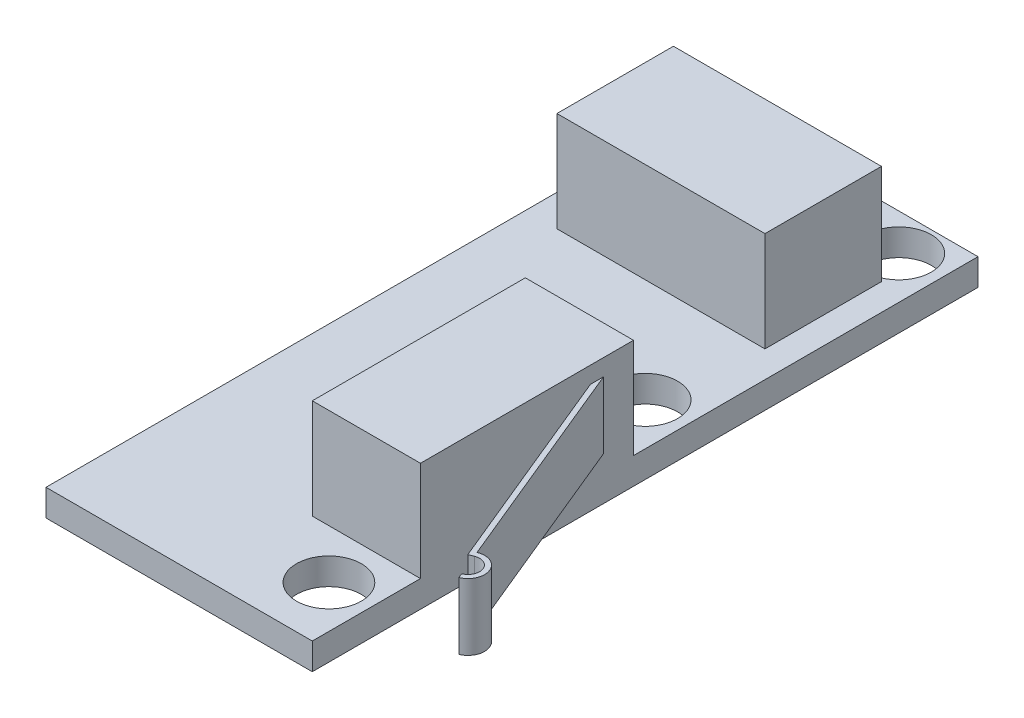
from build123d import *

# Parameters (mm, degrees)
SKETCH1_W           = 16
SKETCH1_H           = 40
BOSS_EXTRUDE1_DEPTH = 1.6
SKETCH2_R           = 1.95
CUT_EXTRUDE1_DEPTH  = 1.6
SKETCH3_W           = 12.5
SKETCH3_H           = 7
SKETCH3_W_2         = 6.5
SKETCH3_H_2         = 12.8
BOSS_EXTRUDE2_DEPTH = 6
BOSS_EXTRUDE3_START = 1
BOSS_EXTRUDE3_DEPTH = 4


with BuildPart() as part:
    # Sketch1 → Boss-Extrude1 (new body)
    with BuildSketch(Plane(origin=(0, 0, 0), x_dir=(1, 0, 0), z_dir=(0, 1, 0))):
        with Locations((8, 20)):
            Rectangle(SKETCH1_W, SKETCH1_H)
    extrude(amount=BOSS_EXTRUDE1_DEPTH)

    # Sketch2 → Cut-Extrude1 (cut)
    with BuildSketch(Plane(origin=(0, 1.6, 0), x_dir=(1, 0, 0), z_dir=(0, 1, 0))):
        with Locations(Location((2.55, 37.792201536, 0), (0, 0, 270))):
            Circle(SKETCH2_R)
        with Locations(Location((13.45, 37.792201536, 0), (0, 0, 270))):
            Circle(SKETCH2_R)
        with Locations(Location((13.45, 3.55, 0), (0, 0, 270))):
            Circle(SKETCH2_R)
        with Locations(Location((13.45, 22.55, 0), (0, 0, 270))):
            Circle(SKETCH2_R)
    extrude(amount=-CUT_EXTRUDE1_DEPTH, mode=Mode.SUBTRACT)

    # Sketch3 → Boss-Extrude2 (add)
    with BuildSketch(Plane(origin=(0, 1.6, 0), x_dir=(1, 0, 0), z_dir=(0, 1, 0))):
        with Locations((8.15, 32.3)):
            Rectangle(SKETCH3_W, SKETCH3_H)
        with Locations((12.75, 12.9)):
            Rectangle(SKETCH3_W_2, SKETCH3_H_2)
    extrude(amount=BOSS_EXTRUDE2_DEPTH)

    # Sketch4 → Boss-Extrude3 (add)
    with BuildSketch(Plane(origin=(0.760107299, 7.6, -17.342959561), x_dir=(1, 0, 0), z_dir=(0, -1, 0)).offset(BOSS_EXTRUDE3_START)):
        with BuildLine():
            Line((15.239892701, -0.157040439), (20.579395829, 12.784740982))
            ThreePointArc((20.579395829, 12.784740982), (21.885201868, 13.32776086), (21.34218199, 14.633566899))
            Line((21.34218199, 14.633566899), (21.227764066, 14.356243012))
            ThreePointArc((21.227764066, 14.356243012), (21.60787798, 13.442178784), (20.693813753, 13.06206487))
            Line((20.693813753, 13.06206487), (20.416533297, 13.176588062))
            Line((20.416533297, 13.176588062), (15.239892701, 0.629549605))
            Line((15.239892701, 0.629549605), (15.239892701, -0.157040439))
        make_face()
    extrude(amount=BOSS_EXTRUDE3_DEPTH)


solid = part.part
